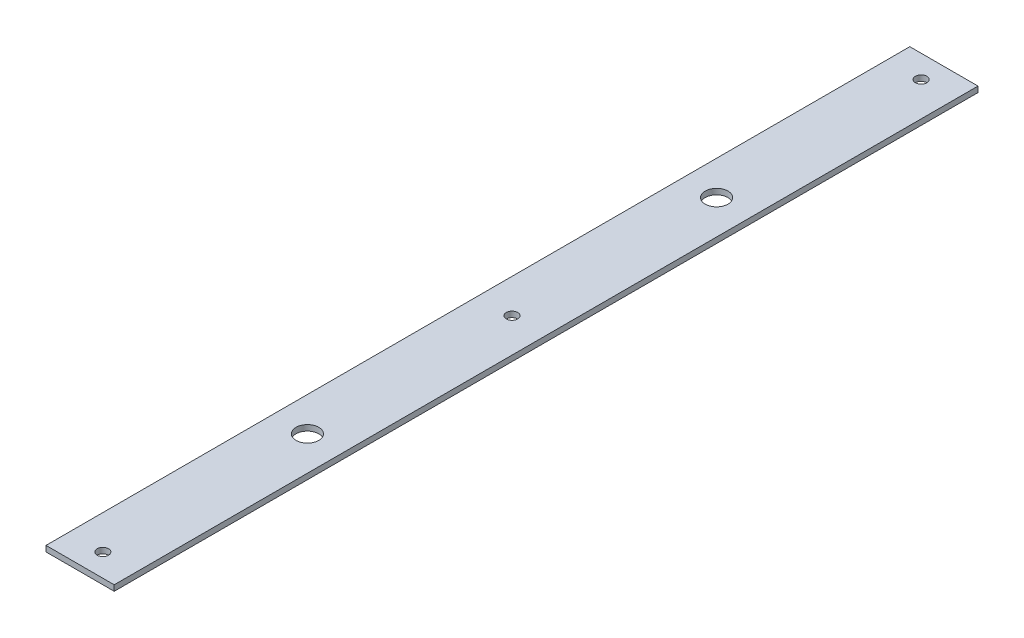
from build123d import *

# Parameters (mm, degrees)
SKETCH1_W        = 38.1
SKETCH1_H        = 482.6
EXTRUSION1_DEPTH = 3.175
HOLE1_D          = 6.35
HOLE2_D          = 12.7
EXTRUSION2_START = -3.175
SKETCH6_R        = 6.35
EXTRUSION2_DEPTH = 3.175
HOLE3_D          = 12.7
HOLE4_D          = 3.96875
EXTRUSION3_START = -3.175
SKETCH11_R       = 1.984375
EXTRUSION3_DEPTH = 3.175


with BuildPart() as part:
    # Sketch1 → Extrusion1 (new body)
    with BuildSketch(Plane(origin=(0, 0, 0), x_dir=(-1, 0, 0), z_dir=(0, 1, 0))):
        Rectangle(SKETCH1_W, SKETCH1_H)
    extrude(amount=EXTRUSION1_DEPTH)

    # Hole1 (through all)
    with Locations(Plane(origin=(0, 3.175, 0), x_dir=(1, 0, 0), z_dir=(0, 1, 0))):
        with Locations((0, -228.6), (0, 228.6), (0, 0)):
            Hole(HOLE1_D / 2)

    # Hole2 (through all)
    with Locations(Plane(origin=(0, 3.175, 0), x_dir=(1, 0, 0), z_dir=(0, 1, 0))):
        with Locations((0, -101.6), (0, 101.6)):
            Hole(HOLE2_D / 2)

    # Sketch6 → Extrusion2 (add)
    with BuildSketch(Plane(origin=(0, 3.175, 0), x_dir=(1, 0, 0), z_dir=(0, 1, 0)).offset(EXTRUSION2_START)):
        with Locations((0, -101.6)):
            Circle(SKETCH6_R)
        with Locations((0, 101.6)):
            Circle(SKETCH6_R)
    extrude(amount=EXTRUSION2_DEPTH)

    # Hole3 (through all)
    with Locations(Plane(origin=(0, 3.175, 0), x_dir=(1, 0, 0), z_dir=(0, 1, 0))):
        with Locations((0, 114.3), (0, -114.3)):
            Hole(HOLE3_D / 2)

    # Hole4 (through all)
    with Locations(Plane(origin=(0, 3.175, 0), x_dir=(1, 0, 0), z_dir=(0, 1, 0))):
        with Locations((0, -88.9), (0, -139.7), (0, 88.9), (0, 139.7)):
            Hole(HOLE4_D / 2)

    # Sketch11 → Extrusion3 (add)
    with BuildSketch(Plane(origin=(0, 3.175, 0), x_dir=(1, 0, 0), z_dir=(0, 1, 0)).offset(EXTRUSION3_START)):
        with Locations((0, 88.9)):
            Circle(SKETCH11_R)
        with Locations((0, -88.9)):
            Circle(SKETCH11_R)
        with Locations((0, -139.7)):
            Circle(SKETCH11_R)
        with Locations((0, 139.7)):
            Circle(SKETCH11_R)
    extrude(amount=EXTRUSION3_DEPTH)


solid = part.part
